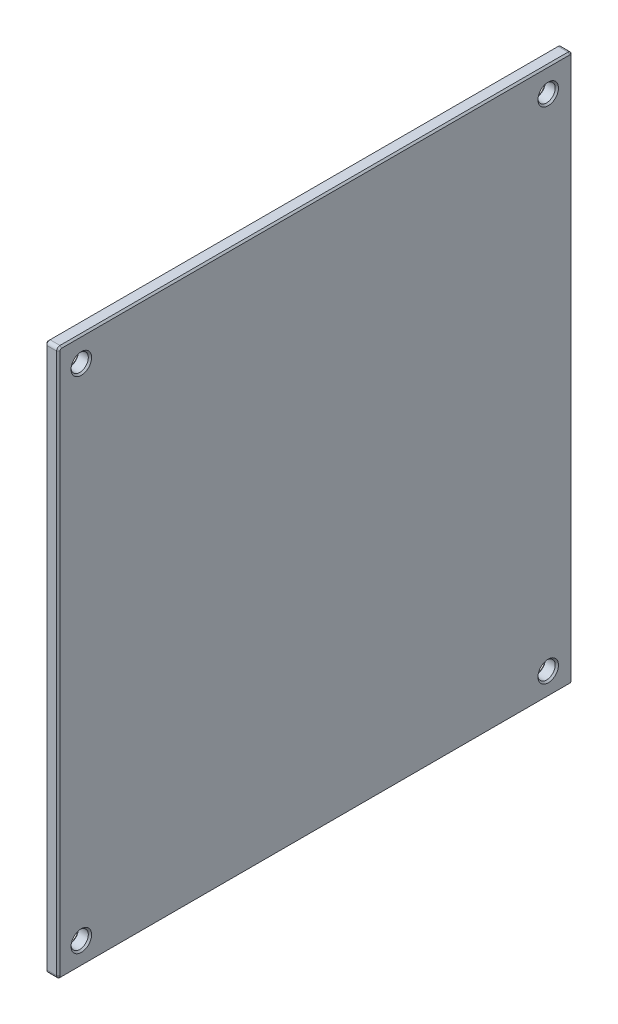
from build123d import *

# Parameters (mm, degrees)
SKETCH_1_W          = 65.8
SKETCH_1_H          = 69.8
EXTRUDE_1_DEPTH     = 1.6
SKETCH_2_R          = 1.05
CUT_EXTRUDE_1_DEPTH = 1.6
SKETCH_5_W          = 65.8
SKETCH_5_H          = 69.8
SKETCH_5_W_2        = 62.6
SKETCH_5_H_2        = 66.6
CUT_EXTRUDE_2_DEPTH = 1.6
FILLET_2_R          = 0.4
CHAMFER_1_SIZE      = 0.2


with BuildPart() as part:
    # 草图1 → 凸台-拉伸1 (new body)
    with BuildSketch(Plane(origin=(0, 0, 0), x_dir=(0, 0, -1), z_dir=(1, 0, 0))):
        with Locations((32.9, -34.9)):
            Rectangle(SKETCH_1_W, SKETCH_1_H)
    extrude(amount=EXTRUDE_1_DEPTH)

    # 草图2 → 切除-拉伸1 (cut)
    with BuildSketch(Plane(origin=(1.6, 0, 0), x_dir=(0, 0, -1), z_dir=(1, 0, 0))):
        with Locations((61.2, -4.6)):
            Circle(SKETCH_2_R)
        with Locations((4.4, -4.6)):
            Circle(SKETCH_2_R)
        with Locations((4.4, -65.4)):
            Circle(SKETCH_2_R)
        with Locations((61.2, -65.4)):
            Circle(SKETCH_2_R)
    extrude(amount=-CUT_EXTRUDE_1_DEPTH, mode=Mode.SUBTRACT)

    # 草图5 → 切除-拉伸2 (cut)
    with BuildSketch(Plane.ZY):
        with Locations((-32.9, -34.9)):
            Rectangle(SKETCH_5_W, SKETCH_5_H)
        with Locations((-32.9, -34.9)):
            Rectangle(SKETCH_5_W_2, SKETCH_5_H_2, mode=Mode.SUBTRACT)
    extrude(amount=-CUT_EXTRUDE_2_DEPTH, mode=Mode.SUBTRACT)

    # 圆角2
    fillet_2_edges = [part.edges().sort_by_distance(p)[0] for p in [
        (0.8, -1.6, -1.6),
        (0.8, -68.2, -1.6),
        (0.8, -68.2, -64.2),
        (0.8, -1.6, -64.2),
    ]]
    fillet(fillet_2_edges, radius=FILLET_2_R)

    # 倒角1
    chamfer_1_edges = [part.edges().sort_by_distance(p)[0] for p in [
        (0, -65.4, -60.15),
        (1.6, -65.4, -60.15),
        (0, -65.4, -3.35),
        (1.6, -65.4, -3.35),
        (0, -4.6, -3.35),
        (1.6, -4.6, -3.35),
        (0, -4.6, -60.15),
        (1.6, -4.6, -60.15),
        (0, -34.9, -1.6),
        (1.6, -34.9, -1.6),
        (0, -1.6, -32.9),
        (0, -34.9, -64.2),
        (0, -68.2, -32.9),
        (0, -1.717157288, -64.082842712),
        (0, -68.082842712, -64.082842712),
        (0, -68.082842712, -1.717157288),
        (0, -1.717157288, -1.717157288),
        (1.6, -1.6, -32.9),
        (1.6, -34.9, -64.2),
        (1.6, -68.2, -32.9),
        (1.6, -1.717157288, -64.082842712),
        (1.6, -68.082842712, -64.082842712),
        (1.6, -68.082842712, -1.717157288),
        (1.6, -1.717157288, -1.717157288),
    ]]
    chamfer(chamfer_1_edges, length=CHAMFER_1_SIZE)


solid = part.part
